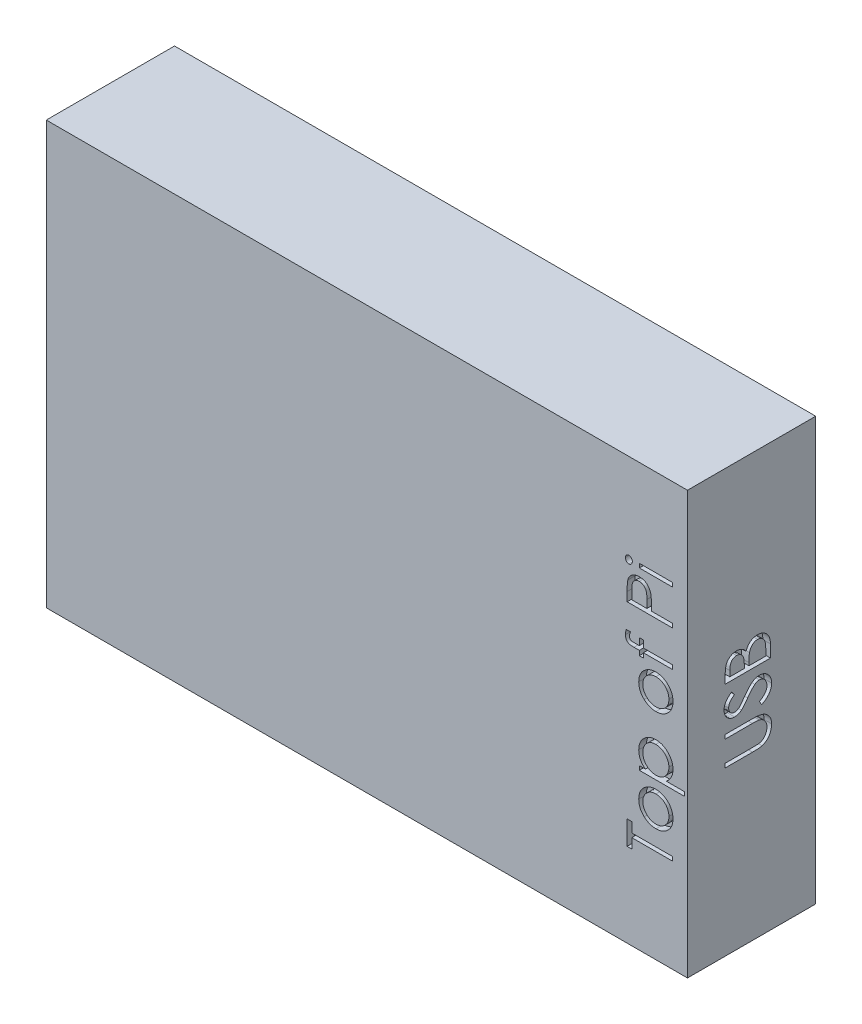
from build123d import *

# Parameters (mm, degrees)
SKETCH1_W           = 85
SKETCH1_H           = 56
BOSS_EXTRUDE1_DEPTH = 17
CUT_EXTRUDE1_DEPTH  = 1
SKETCH3_W           = 4.384615385
SKETCH3_H           = 0.538461538
CUT_EXTRUDE2_DEPTH  = 1


with BuildPart() as part:
    # Sketch1 → Boss-Extrude1 (new body)
    with BuildSketch(Plane.XY):
        with Locations((42.5, 28)):
            Rectangle(SKETCH1_W, SKETCH1_H)
    extrude(amount=BOSS_EXTRUDE1_DEPTH)

    # Sketch2 → Cut-Extrude1 (cut)
    # profile 1 of 3: a face of its own
    with BuildSketch(Plane(origin=(85, 0, 0), x_dir=(0, 0, -1), z_dir=(1, 0, 0))):
        with BuildLine():
            Line((-12, 21.615384615), (-12, 22.153846154))
            Line((-12, 22.153846154), (-8.405048077, 22.153846154))
            add(Edge.make_bspline(
                [(-8.405048077, 22.153846154), (-8.354166816, 22.153766021), (-8.257610854, 22.153613956), (-8.120179482, 22.154629694), (-7.997998123, 22.157474326), (-7.890595813, 22.159267742), (-7.798465389, 22.163257457), (-7.721107714, 22.166511251), (-7.658889081, 22.170695063), (-7.622578922, 22.175723264), (-7.606971154, 22.177884615)],
                knots=[0, 0, 0, 0, 1.528628734, 2.90083645, 4.128790002, 5.200304208, 6.127813768, 6.898992206, 7.526736466, 8, 8, 8, 8], degree=3))
            add(Edge.make_bspline(
                [(-7.606971154, 22.177884615), (-7.550230686, 22.186659158), (-7.440695762, 22.203598018), (-7.284828328, 22.248601408), (-7.144094184, 22.308598175), (-7.015318865, 22.383027754), (-6.899320752, 22.477069849), (-6.795209546, 22.593826014), (-6.700598922, 22.731202968), (-6.61811206, 22.887232503), (-6.54959977, 23.053482245), (-6.498334993, 23.223992144), (-6.466960983, 23.395471362), (-6.463337709, 23.510290663), (-6.461538462, 23.567307692)],
                knots=[0, 0, 0, 0, 1.042777144, 2.01303441, 2.939567723, 3.817555404, 4.708046775, 5.641195415, 6.651191522, 7.732783915, 8.843021186, 9.914367358, 10.964315445, 12, 12, 12, 12], degree=3))
            add(Edge.make_bspline(
                [(-6.461538462, 23.567307692), (-6.463369143, 23.616261265), (-6.467019933, 23.713885668), (-6.489905795, 23.85886117), (-6.530338533, 24.000505204), (-6.585415301, 24.137705033), (-6.653144963, 24.268230926), (-6.734283996, 24.388736365), (-6.828795256, 24.496728805), (-6.933539817, 24.595277925), (-7.051574826, 24.680589656), (-7.180052672, 24.756018567), (-7.322399162, 24.815922989), (-7.422376612, 24.846252416), (-7.473557692, 24.861778846)],
                knots=[0, 0, 0, 0, 0.994718802, 1.98369237, 2.973235266, 3.981451368, 4.982709966, 5.955777334, 6.925228988, 7.892833478, 8.871333226, 9.877970804, 10.913677552, 12, 12, 12, 12], degree=3))
            add(Edge.make_bspline(
                [(-7.473557692, 24.861778846), (-7.494726677, 24.866921918), (-7.541899706, 24.878382755), (-7.621650489, 24.889091975), (-7.715746542, 24.900246019), (-7.824863935, 24.907985281), (-7.948637031, 24.915530231), (-8.087710615, 24.92004407), (-8.241579691, 24.922130412), (-8.348957683, 24.92275215), (-8.405048077, 24.923076923)],
                knots=[0, 0, 0, 0, 0.558680831, 1.244966039, 2.062412453, 2.990489873, 4.051219941, 5.244515665, 6.560634259, 8, 8, 8, 8], degree=3))
            Line((-8.405048077, 24.923076923), (-12, 24.923076923))
            Line((-12, 24.923076923), (-12, 25.461538462))
            Line((-12, 25.461538462), (-8.376201923, 25.461538462))
            add(Edge.make_bspline(
                [(-8.376201923, 25.461538462), (-8.310890429, 25.461102765), (-8.183431078, 25.460252475), (-7.99665714, 25.45288092), (-7.819481236, 25.44112302), (-7.651875918, 25.42452532), (-7.494453411, 25.402483171), (-7.346176809, 25.378197749), (-7.207863613, 25.346729836), (-7.077918045, 25.3102462), (-6.953596944, 25.269134125), (-6.83584116, 25.214951023), (-6.721192193, 25.154169825), (-6.610933807, 25.082663947), (-6.505766521, 25.000399547), (-6.402967956, 24.91052827), (-6.305601787, 24.809882412), (-6.212467158, 24.701434738), (-6.125851929, 24.585914396), (-6.050477044, 24.462575475), (-5.98910145, 24.332098915), (-5.934629401, 24.197574308), (-5.895912056, 24.055776345), (-5.86647349, 23.908471323), (-5.849886979, 23.754785501), (-5.847408773, 23.650277224), (-5.846153846, 23.597355769)],
                knots=[0, 0, 0, 0, 1.316707045, 2.569633854, 3.76780728, 4.896239288, 5.964314126, 6.972204208, 7.924543903, 8.822147865, 9.693191779, 10.560896119, 11.431827672, 12.307838457, 13.206132673, 14.12176355, 15.058527151, 16.026630406, 17.00238624, 17.966538933, 18.934743273, 19.906713913, 20.888635248, 21.892958714, 22.933025263, 24, 24, 24, 24], degree=3))
            add(Edge.make_bspline(
                [(-5.846153846, 23.597355769), (-5.847498226, 23.539636886), (-5.850135894, 23.426392644), (-5.865273813, 23.259533356), (-5.89371437, 23.099544404), (-5.930162332, 22.944864336), (-5.979610052, 22.796987534), (-6.040368112, 22.655957577), (-6.109732669, 22.520155147), (-6.191697829, 22.39263984), (-6.281075319, 22.272365607), (-6.379246692, 22.16306383), (-6.482473079, 22.061959872), (-6.594641472, 21.973510172), (-6.713455682, 21.894369268), (-6.839474548, 21.826281069), (-6.972529135, 21.767795686), (-7.065021067, 21.737613751), (-7.111778846, 21.722355769)],
                knots=[0, 0, 0, 0, 1.138939089, 2.234594419, 3.301501784, 4.342532435, 5.367382236, 6.373123747, 7.370098489, 8.372230273, 9.360297234, 10.323289009, 11.268038109, 12.20748145, 13.137029304, 14.081414587, 15.030090602, 16, 16, 16, 16], degree=3))
            add(Edge.make_bspline(
                [(-7.111778846, 21.722355769), (-7.143720402, 21.713480641), (-7.213002349, 21.69423029), (-7.327664901, 21.673615494), (-7.459690474, 21.65628564), (-7.609088106, 21.639990397), (-7.775973591, 21.630375041), (-7.96027459, 21.621945146), (-8.162213953, 21.615325228), (-8.302878837, 21.615364266), (-8.376201923, 21.615384615)],
                knots=[0, 0, 0, 0, 0.625038921, 1.35572334, 2.194682327, 3.136881307, 4.189498639, 5.346923369, 6.617055217, 8, 8, 8, 8], degree=3))
            Line((-8.376201923, 21.615384615), (-12, 21.615384615))
        make_face()
    # profile 2 of 3: a face of its own
    with BuildSketch(Plane(origin=(85, 0, 0), x_dir=(0, 0, -1), z_dir=(1, 0, 0))):
        with BuildLine():
            Line((-7.157451923, 26.461538462), (-7.461538462, 26.96875))
            add(Edge.make_bspline(
                [(-7.461538462, 26.96875), (-7.382570944, 27.015924121), (-7.231272229, 27.106307916), (-7.026829874, 27.257081675), (-6.853066177, 27.413309523), (-6.710991993, 27.57614838), (-6.599136758, 27.744604291), (-6.519932932, 27.919776955), (-6.470534117, 28.101076059), (-6.464533969, 28.224459753), (-6.461538462, 28.286057692)],
                knots=[0, 0, 0, 0, 1.272034388, 2.437168799, 3.508375237, 4.49857839, 5.41946034, 6.295179144, 7.148887113, 8, 8, 8, 8], degree=3))
            add(Edge.make_bspline(
                [(-6.461538462, 28.286057692), (-6.463038471, 28.338653089), (-6.466012244, 28.442923586), (-6.493431903, 28.596727413), (-6.538290409, 28.745354288), (-6.59910097, 28.887326766), (-6.673850371, 29.018883507), (-6.761993942, 29.136095913), (-6.863840684, 29.235069364), (-6.975617656, 29.317119551), (-7.095480057, 29.38060939), (-7.218981235, 29.428595627), (-7.34781572, 29.455470505), (-7.434579988, 29.459503313), (-7.478365385, 29.461538462)],
                knots=[0, 0, 0, 0, 1.09553864, 2.171907928, 3.244545276, 4.325730702, 5.384330216, 6.391480148, 7.371786628, 8.333890167, 9.27165687, 10.191402356, 11.087295184, 12, 12, 12, 12], degree=3))
            add(Edge.make_bspline(
                [(-7.478365385, 29.461538462), (-7.528337801, 29.459065355), (-7.629537393, 29.454057043), (-7.779100964, 29.409918465), (-7.927750556, 29.342520703), (-8.019717224, 29.279174381), (-8.067307692, 29.246394231)],
                knots=[0, 0, 0, 0, 0.938992559, 1.901562324, 2.914110574, 4, 4, 4, 4], degree=3))
            add(Edge.make_bspline(
                [(-8.067307692, 29.246394231), (-8.101678021, 29.219534259), (-8.173834225, 29.163145108), (-8.281149766, 29.066120223), (-8.392069958, 28.952847754), (-8.509029888, 28.824878017), (-8.631058104, 28.681996351), (-8.75910685, 28.524147476), (-8.890559439, 28.349984242), (-8.978607244, 28.227739655), (-9.024038462, 28.164663462)],
                knots=[0, 0, 0, 0, 0.72225051, 1.516274602, 2.393638633, 3.3469932, 4.386926276, 5.505032946, 6.712638081, 8, 8, 8, 8], degree=3))
            add(Edge.make_bspline(
                [(-9.024038462, 28.164663462), (-9.069001755, 28.101536611), (-9.154968147, 27.98084288), (-9.282552634, 27.812056739), (-9.399199267, 27.661123373), (-9.506006145, 27.528713631), (-9.602987753, 27.41488575), (-9.689212792, 27.31874276), (-9.767013182, 27.242733805), (-9.817484054, 27.200467095), (-9.840144231, 27.181490385)],
                knots=[0, 0, 0, 0, 1.452282411, 2.77665338, 3.964542531, 5.026858415, 5.96415736, 6.766646006, 7.446254459, 8, 8, 8, 8], degree=3))
            add(Edge.make_bspline(
                [(-9.840144231, 27.181490385), (-9.875462047, 27.154970467), (-9.944919273, 27.10281549), (-10.05345119, 27.033896129), (-10.164339908, 26.975776244), (-10.277987314, 26.929000603), (-10.393539278, 26.891174914), (-10.511863321, 26.864876357), (-10.632156186, 26.848666482), (-10.713090814, 26.846992049), (-10.753605769, 26.846153846)],
                knots=[0, 0, 0, 0, 1.068019517, 2.100403715, 3.106014851, 4.09224787, 5.069873182, 6.043214339, 7.020455327, 8, 8, 8, 8], degree=3))
            add(Edge.make_bspline(
                [(-10.753605769, 26.846153846), (-10.817085507, 26.848391248), (-10.942688147, 26.852818228), (-11.12616777, 26.89026056), (-11.301351196, 26.949351563), (-11.466463705, 27.032163029), (-11.617356803, 27.13881426), (-11.755388673, 27.262772932), (-11.873011906, 27.409047543), (-11.974180246, 27.57098441), (-12.054184634, 27.747305723), (-12.112164093, 27.932933723), (-12.146603163, 28.126534058), (-12.151408101, 28.257875729), (-12.153846154, 28.324519231)],
                knots=[0, 0, 0, 0, 1.005248779, 1.989011071, 2.95484373, 3.928844559, 4.904706341, 5.875556129, 6.859318422, 7.868909462, 8.894684146, 9.918924798, 10.944050749, 12, 12, 12, 12], degree=3))
            add(Edge.make_bspline(
                [(-12.153846154, 28.324519231), (-12.151440607, 28.395234851), (-12.146656743, 28.53586565), (-12.104027118, 28.742395455), (-12.03618014, 28.94205422), (-11.95657786, 29.101954632), (-11.877580259, 29.227365604), (-11.8054695, 29.322911484), (-11.72262443, 29.420259229), (-11.627298548, 29.518362642), (-11.521398466, 29.618190208), (-11.404027732, 29.719282098), (-11.276244048, 29.822584357), (-11.184998145, 29.889019241), (-11.138221154, 29.923076923)],
                knots=[0, 0, 0, 0, 1.286507425, 2.558452658, 3.822738219, 5.118007103, 5.800084425, 6.519418873, 7.295692132, 8.12638276, 9.008892966, 9.945018126, 10.946518512, 12, 12, 12, 12], degree=3))
            Line((-11.138221154, 29.923076923), (-10.769230769, 29.436298077))
            add(Edge.make_bspline(
                [(-10.769230769, 29.436298077), (-10.807099287, 29.406907193), (-10.880025199, 29.350307222), (-10.982118303, 29.264342453), (-11.075502479, 29.183441366), (-11.156400582, 29.10312428), (-11.23087058, 29.029582016), (-11.293497436, 28.956937142), (-11.346259861, 28.887993037), (-11.402669915, 28.801297729), (-11.45689589, 28.691474633), (-11.504527036, 28.554762553), (-11.532784373, 28.411409992), (-11.536553467, 28.313824753), (-11.538461538, 28.264423077)],
                knots=[0, 0, 0, 0, 1.181392137, 2.275085037, 3.289537922, 4.225335853, 5.084247276, 5.86831218, 6.587234301, 7.222706459, 8.415108401, 9.595592188, 10.782789524, 12, 12, 12, 12], degree=3))
            add(Edge.make_bspline(
                [(-11.538461538, 28.264423077), (-11.536418352, 28.20242584), (-11.532478258, 28.082870009), (-11.488314189, 27.913531167), (-11.421165697, 27.760237257), (-11.324338272, 27.628840248), (-11.208901332, 27.520347776), (-11.077253631, 27.440894582), (-10.931853868, 27.393390914), (-10.83047618, 27.387576548), (-10.778846154, 27.384615385)],
                knots=[0, 0, 0, 0, 1.144248881, 2.206576175, 3.214949548, 4.222996039, 5.203671638, 6.127710127, 7.046472867, 8, 8, 8, 8], degree=3))
            add(Edge.make_bspline(
                [(-10.778846154, 27.384615385), (-10.746708133, 27.385327816), (-10.681984397, 27.386762603), (-10.586815639, 27.405096858), (-10.492148675, 27.429886277), (-10.398316684, 27.467889646), (-10.303194902, 27.520812484), (-10.205439813, 27.590235912), (-10.10420941, 27.677691649), (-10.038368033, 27.744680161), (-10.003605769, 27.780048077)],
                knots=[0, 0, 0, 0, 0.858259122, 1.72847414, 2.583651051, 3.473048463, 4.427392529, 5.488649985, 6.674082839, 8, 8, 8, 8], degree=3))
            add(Edge.make_bspline(
                [(-10.003605769, 27.780048077), (-9.991885154, 27.793181858), (-9.964039654, 27.824384716), (-9.918452887, 27.88142916), (-9.862219563, 27.956759672), (-9.792641306, 28.048409159), (-9.711930228, 28.158067494), (-9.621118322, 28.285746733), (-9.517257535, 28.430023646), (-9.444644608, 28.532404073), (-9.40625, 28.586538462)],
                knots=[0, 0, 0, 0, 0.420754252, 0.999615792, 1.744751191, 2.668019286, 3.750313428, 4.999500688, 6.413464383, 8, 8, 8, 8], degree=3))
            add(Edge.make_bspline(
                [(-9.40625, 28.586538462), (-9.358864779, 28.651657124), (-9.267109865, 28.777750389), (-9.129254866, 28.957164004), (-8.99442857, 29.119836976), (-8.863500737, 29.266352473), (-8.737435232, 29.398117653), (-8.61481311, 29.513804247), (-8.49643851, 29.613937153), (-8.345706932, 29.723209586), (-8.158869622, 29.83354235), (-7.929855494, 29.928143627), (-7.700184167, 29.988327339), (-7.546016905, 29.996143543), (-7.469951923, 30)],
                knots=[0, 0, 0, 0, 1.163604038, 2.253157948, 3.268574773, 4.215621239, 5.091738613, 5.902582348, 6.650434646, 7.330118262, 8.591011492, 9.77460283, 10.902005569, 12, 12, 12, 12], degree=3))
            add(Edge.make_bspline(
                [(-7.469951923, 30), (-7.41616101, 29.998872329), (-7.309623767, 29.996638886), (-7.153178206, 29.971008302), (-7.001270389, 29.933369638), (-6.855928256, 29.877096706), (-6.714819752, 29.807293512), (-6.580603088, 29.719989816), (-6.450670723, 29.618264486), (-6.328665336, 29.501633276), (-6.216526665, 29.374077268), (-6.117186369, 29.238774096), (-6.032448299, 29.097136201), (-5.964962736, 28.947629741), (-5.911825906, 28.791860811), (-5.873433418, 28.629315744), (-5.849844176, 28.459829885), (-5.847397689, 28.344628408), (-5.846153846, 28.286057692)],
                knots=[0, 0, 0, 0, 0.983922938, 1.948738757, 2.895227473, 3.844781104, 4.796118043, 5.772795661, 6.770647148, 7.813532943, 8.8582745, 9.876489951, 10.882905461, 11.874265028, 12.874055871, 13.891769171, 14.928133632, 16, 16, 16, 16], degree=3))
            add(Edge.make_bspline(
                [(-5.846153846, 28.286057692), (-5.847030158, 28.240739962), (-5.848771744, 28.15067523), (-5.864168223, 28.017458974), (-5.885951835, 27.886933971), (-5.920535934, 27.760738034), (-5.962496544, 27.637245419), (-6.014161964, 27.516992674), (-6.076078276, 27.399923596), (-6.146865487, 27.285374175), (-6.229266766, 27.173666448), (-6.325155256, 27.065727046), (-6.432085826, 26.958716387), (-6.551710372, 26.853393566), (-6.68534435, 26.752056396), (-6.830997227, 26.652272096), (-6.989102143, 26.55452696), (-7.10028719, 26.493113571), (-7.157451923, 26.461538462)],
                knots=[0, 0, 0, 0, 0.915313873, 1.819100311, 2.706792138, 3.586475221, 4.459428225, 5.3405999, 6.2277379, 7.133009489, 8.059106158, 9.028520402, 10.047404263, 11.114294124, 12.246039232, 13.433834781, 14.680630578, 16, 16, 16, 16], degree=3))
        make_face()
    # profile 3 of 3: a face of its own
    with BuildSketch(Plane(origin=(85, 0, 0), x_dir=(0, 0, -1), z_dir=(1, 0, 0))):
        with BuildLine():
            Line((-12, 31.230769231), (-12, 32.401442308))
            add(Edge.make_bspline(
                [(-12, 32.401442308), (-11.999703457, 32.458749174), (-11.999128682, 32.569824143), (-11.990007425, 32.731330904), (-11.977881577, 32.882657127), (-11.95754112, 33.0235354), (-11.936450748, 33.154882396), (-11.905495132, 33.275364667), (-11.871303525, 33.385991404), (-11.818695099, 33.51883147), (-11.736993549, 33.669556728), (-11.615822388, 33.831558178), (-11.47054795, 33.972379723), (-11.304996269, 34.092119777), (-11.122870659, 34.188213719), (-10.928089612, 34.256853949), (-10.723930087, 34.300951048), (-10.583959855, 34.305429148), (-10.513221154, 34.307692308)],
                knots=[0, 0, 0, 0, 1.00128172, 1.940733171, 2.826250472, 3.653024905, 4.427672124, 5.149348099, 5.824709082, 6.450061444, 7.643590664, 8.808605388, 9.972104426, 11.165284501, 12.367876273, 13.557044126, 14.765369432, 16, 16, 16, 16], degree=3))
            add(Edge.make_bspline(
                [(-10.513221154, 34.307692308), (-10.446962543, 34.305807261), (-10.316758125, 34.302102966), (-10.126647541, 34.267112731), (-9.945863489, 34.211578227), (-9.774560694, 34.134827303), (-9.61592797, 34.035938032), (-9.47045672, 33.917454785), (-9.343644957, 33.77509811), (-9.272776706, 33.668387067), (-9.236778846, 33.614182692)],
                knots=[0, 0, 0, 0, 1.044641374, 2.052818814, 3.038628718, 4.023282556, 5.005660861, 5.98021751, 6.974042014, 8, 8, 8, 8], degree=3))
            add(Edge.make_bspline(
                [(-9.236778846, 33.614182692), (-9.210601803, 33.682336844), (-9.160518635, 33.812732618), (-9.072110629, 33.992279742), (-8.975604841, 34.146406862), (-8.871843881, 34.278124774), (-8.758351089, 34.390182622), (-8.634204387, 34.487231198), (-8.499505409, 34.571131582), (-8.354749217, 34.64253023), (-8.201162974, 34.698614757), (-8.040622586, 34.739836108), (-7.873743483, 34.764219433), (-7.760495982, 34.767545692), (-7.703125, 34.769230769)],
                knots=[0, 0, 0, 0, 1.272586185, 2.434772614, 3.483318042, 4.437947805, 5.351807173, 6.25737843, 7.180033415, 8.1141739, 9.066731021, 10.025721652, 10.999834114, 12, 12, 12, 12], degree=3))
            add(Edge.make_bspline(
                [(-7.703125, 34.769230769), (-7.644552981, 34.767556542), (-7.529310892, 34.764262453), (-7.36001978, 34.739948702), (-7.198221646, 34.698809447), (-7.04294451, 34.64204536), (-6.894513934, 34.568469655), (-6.753467632, 34.477636329), (-6.61951216, 34.370820499), (-6.492411103, 34.250101346), (-6.37610964, 34.115569293), (-6.276129603, 33.967306313), (-6.19016102, 33.809374087), (-6.120168465, 33.639753604), (-6.066169256, 33.458877869), (-6.028546659, 33.266847531), (-6.003154075, 33.063978835), (-6.001069198, 32.9247611), (-6, 32.853365385)],
                knots=[0, 0, 0, 0, 0.978680899, 1.925582087, 2.851223405, 3.764209995, 4.683484765, 5.614004905, 6.562443559, 7.542772147, 8.539900013, 9.527881485, 10.525548727, 11.540192123, 12.58875426, 13.674701727, 14.807505862, 16, 16, 16, 16], degree=3))
            Line((-6, 32.853365385), (-6, 31.230769231))
            Line((-6, 31.230769231), (-12, 31.230769231))
        make_face()
        with BuildLine():
            Line((-11.384615385, 31.769230769), (-9.461538462, 31.769230769))
            Line((-9.461538462, 31.769230769), (-9.461538462, 32.131009615))
            add(Edge.make_bspline(
                [(-9.461538462, 32.131009615), (-9.462224044, 32.183893265), (-9.463548728, 32.286075252), (-9.46734333, 32.434052216), (-9.477968543, 32.571409396), (-9.488590722, 32.697909663), (-9.505861394, 32.81335391), (-9.52641948, 32.917486057), (-9.548161084, 33.011941399), (-9.585139539, 33.120863784), (-9.639772111, 33.244434712), (-9.724639719, 33.376080253), (-9.825642887, 33.492675365), (-9.94327669, 33.589952684), (-10.071400586, 33.670269634), (-10.208889768, 33.726534183), (-10.352977443, 33.764044083), (-10.452084821, 33.767484164), (-10.502403846, 33.769230769)],
                knots=[0, 0, 0, 0, 1.156917035, 2.235399477, 3.236897345, 4.169954739, 5.01148057, 5.788325709, 6.491867502, 7.129259015, 8.302032419, 9.437271567, 10.542795419, 11.662606952, 12.764338259, 13.836858145, 14.901724648, 16, 16, 16, 16], degree=3))
            add(Edge.make_bspline(
                [(-10.502403846, 33.769230769), (-10.535709534, 33.76834395), (-10.601042278, 33.766604358), (-10.696591752, 33.751839518), (-10.786373211, 33.727916558), (-10.87124833, 33.695518421), (-10.949107761, 33.651257758), (-11.023671827, 33.599953835), (-11.090474506, 33.536611858), (-11.152731939, 33.4650298), (-11.208452134, 33.383127159), (-11.254607679, 33.289139339), (-11.296439938, 33.185496071), (-11.327407116, 33.069385455), (-11.354637894, 32.943213343), (-11.371747174, 32.805271318), (-11.382757158, 32.656433489), (-11.38398216, 32.553307568), (-11.384615385, 32.5)],
                knots=[0, 0, 0, 0, 0.911708768, 1.788416306, 2.640049961, 3.452993646, 4.268229297, 5.087074648, 5.92553149, 6.781184137, 7.681934069, 8.628939405, 9.643570426, 10.73771997, 11.914765019, 13.176320755, 14.540391495, 16, 16, 16, 16], degree=3))
            Line((-11.384615385, 32.5), (-11.384615385, 31.769230769))
        make_face(mode=Mode.SUBTRACT)
        with BuildLine():
            Line((-8.846153846, 31.769230769), (-6.615384615, 31.769230769))
            Line((-6.615384615, 31.769230769), (-6.615384615, 32.536057692))
            add(Edge.make_bspline(
                [(-6.615384615, 32.536057692), (-6.616107881, 32.590941539), (-6.617501879, 32.696722917), (-6.620771096, 32.84957333), (-6.633138046, 32.990872345), (-6.644546502, 33.121065711), (-6.664054471, 33.239807893), (-6.682464922, 33.348012263), (-6.709793921, 33.443902572), (-6.747354415, 33.556116419), (-6.807484103, 33.681545563), (-6.89533301, 33.81861704), (-7.003752122, 33.938141244), (-7.12705833, 34.040741615), (-7.260759887, 34.125411897), (-7.403108902, 34.186170834), (-7.551336955, 34.223928604), (-7.65242713, 34.228484431), (-7.703125, 34.230769231)],
                knots=[0, 0, 0, 0, 1.160376723, 2.23647316, 3.230273494, 4.158083346, 4.997711197, 5.773399541, 6.476071462, 7.102777513, 8.27340052, 9.405620712, 10.53304798, 11.669441455, 12.787990954, 13.865552736, 14.929550474, 16, 16, 16, 16], degree=3))
            add(Edge.make_bspline(
                [(-7.703125, 34.230769231), (-7.734828552, 34.230297359), (-7.797724276, 34.229361226), (-7.89014144, 34.215179039), (-7.979708286, 34.194661909), (-8.066798055, 34.167640259), (-8.149946445, 34.129865449), (-8.229472333, 34.083556698), (-8.306977741, 34.030548104), (-8.406230129, 33.948765871), (-8.51916558, 33.828076158), (-8.628370556, 33.656562607), (-8.717862978, 33.462622395), (-8.755696543, 33.321630728), (-8.775240385, 33.248798077)],
                knots=[0, 0, 0, 0, 0.723302347, 1.434937762, 2.129609326, 2.821140842, 3.513216847, 4.209993937, 4.920569932, 5.655069131, 7.14393391, 8.6716197, 10.280644748, 12, 12, 12, 12], degree=3))
            add(Edge.make_bspline(
                [(-8.775240385, 33.248798077), (-8.781163386, 33.219605341), (-8.794005674, 33.156309469), (-8.807561737, 33.053096474), (-8.819638982, 32.935263555), (-8.828572395, 32.802538623), (-8.83780647, 32.654753753), (-8.841397592, 32.491593321), (-8.845682038, 32.313723638), (-8.845992554, 32.190308143), (-8.846153846, 32.126201923)],
                knots=[0, 0, 0, 0, 0.634451884, 1.375622551, 2.216452059, 3.157844607, 4.20941857, 5.370758133, 6.634282058, 8, 8, 8, 8], degree=3))
            Line((-8.846153846, 32.126201923), (-8.846153846, 31.769230769))
        make_face(mode=Mode.SUBTRACT)
    extrude(amount=-CUT_EXTRUDE1_DEPTH, mode=Mode.SUBTRACT)

    # Sketch3 → Cut-Extrude2 (cut)
    # profile 1 of 8: a face of its own
    with BuildSketch(Plane.XY.offset(17)):
        Polygon((77.615384615, 11.115384615), (77, 11.115384615), (77, 14.269230769), (77.615384615, 14.269230769), (77.615384615, 12.961538462), (83, 12.961538462), (83, 12.423076923), (77.615384615, 12.423076923), align=None)
    # profile 2 of 8: a face of its own
    with BuildSketch(Plane.XY.offset(17)):
        with BuildLine():
            add(Edge.make_bspline(
                [(78.538461538, 17.310096154), (78.540213352, 17.392366907), (78.54364823, 17.553679749), (78.580359599, 17.789921839), (78.636497938, 18.015427786), (78.714106331, 18.231061259), (78.818132531, 18.434060622), (78.942262745, 18.627382755), (79.08931862, 18.810497627), (79.203075308, 18.920251392), (79.260817308, 18.975961538)],
                knots=[0, 0, 0, 0, 1.054011418, 2.066658804, 3.057071809, 4.030435133, 4.997543892, 5.974964718, 6.972108034, 8, 8, 8, 8], degree=3))
            add(Edge.make_bspline(
                [(79.260817308, 18.975961538), (79.316041283, 19.023930603), (79.425420499, 19.118940397), (79.602772978, 19.240767344), (79.786441722, 19.34571859), (79.97886571, 19.429826523), (80.178365147, 19.496143706), (80.385625737, 19.543227757), (80.600189761, 19.571233931), (80.745910626, 19.575010446), (80.819711538, 19.576923077)],
                knots=[0, 0, 0, 0, 1.025258237, 2.030674902, 3.01204498, 3.988269485, 4.97094183, 5.956517959, 6.965070386, 8, 8, 8, 8], degree=3))
            add(Edge.make_bspline(
                [(80.819711538, 19.576923077), (80.893940209, 19.575240784), (81.040619523, 19.571916496), (81.256652722, 19.540470296), (81.46612956, 19.491559863), (81.668173035, 19.421562427), (81.86340074, 19.331805668), (82.050959967, 19.222278775), (82.231220767, 19.092213145), (82.40265249, 18.944777722), (82.560651715, 18.781831649), (82.69835732, 18.605061109), (82.816337076, 18.417939908), (82.911370931, 18.217979874), (82.986301846, 18.00700704), (83.038930446, 17.784566351), (83.070750475, 17.551003374), (83.074836601, 17.391528137), (83.076923077, 17.310096154)],
                knots=[0, 0, 0, 0, 0.998656419, 1.973391657, 2.932242238, 3.890759089, 4.846373663, 5.82037756, 6.809684879, 7.83454468, 8.860553229, 9.859544525, 10.845671541, 11.83227036, 12.833544569, 13.85385346, 14.904124723, 16, 16, 16, 16], degree=3))
            add(Edge.make_bspline(
                [(83.076923077, 17.310096154), (83.074829598, 17.228265206), (83.070729413, 17.067995161), (83.039054071, 16.833607763), (82.986326101, 16.610768417), (82.911124685, 16.399519391), (82.816334038, 16.198699653), (82.698713999, 16.01049423), (82.560610876, 15.833580089), (82.402663555, 15.670599544), (82.231217916, 15.523173363), (82.050960707, 15.393105349), (81.863400547, 15.283579076), (81.668173087, 15.193822155), (81.466129547, 15.123824761), (81.256652725, 15.074914317), (81.040619522, 15.04346812), (80.893940208, 15.040143831), (80.819711538, 15.038461538)],
                knots=[0, 0, 0, 0, 1.099876186, 2.154163076, 3.173186993, 4.173200201, 5.163417411, 6.152872554, 7.150605724, 8.17532212, 9.198891216, 10.186952605, 11.159729845, 12.11414092, 13.071450619, 14.029093627, 15.002601286, 16, 16, 16, 16], degree=3))
            add(Edge.make_bspline(
                [(80.819711538, 15.038461538), (80.746310108, 15.040382638), (80.60098789, 15.044186086), (80.386850976, 15.07223048), (80.180224723, 15.11880222), (79.981814714, 15.186038749), (79.789853212, 15.269990552), (79.60551104, 15.373885509), (79.428933516, 15.496890927), (79.319699351, 15.591531611), (79.264423077, 15.639423077)],
                knots=[0, 0, 0, 0, 1.031377469, 2.041950136, 3.029500481, 4.003457997, 4.981637986, 5.969878303, 6.97268806, 8, 8, 8, 8], degree=3))
            add(Edge.make_bspline(
                [(79.264423077, 15.639423077), (79.206180324, 15.695049233), (79.091635702, 15.804447857), (78.945008518, 15.988474247), (78.818295248, 16.181320798), (78.716336022, 16.386563528), (78.63604142, 16.602019856), (78.580214823, 16.828681415), (78.5437805, 17.065725155), (78.540252195, 17.227827363), (78.538461538, 17.310096154)],
                knots=[0, 0, 0, 0, 1.027980169, 2.021703884, 2.998553061, 3.971491411, 4.943284454, 5.930300938, 6.949603206, 8, 8, 8, 8], degree=3))
        make_face()
        with BuildLine():
            add(Edge.make_bspline(
                [(79.076923077, 17.307692308), (79.078576663, 17.249513545), (79.081841147, 17.134657896), (79.106670699, 16.965595752), (79.146009274, 16.802841196), (79.201901953, 16.646085488), (79.274071453, 16.495857101), (79.362714512, 16.352012755), (79.466656121, 16.214127244), (79.585737319, 16.084905996), (79.715806937, 15.966288648), (79.854435399, 15.862681099), (79.999499204, 15.774085485), (80.151216646, 15.701619533), (80.310105027, 15.646043294), (80.475228646, 15.606660915), (80.647086121, 15.581785899), (80.763937169, 15.578561578), (80.823317308, 15.576923077)],
                knots=[0, 0, 0, 0, 1.02155314, 2.01673505, 2.994700672, 3.958461264, 4.934171024, 5.916582427, 6.921469794, 7.962398674, 8.998583302, 10.009097305, 10.997513862, 11.97957236, 12.956600784, 13.948243505, 14.957359924, 16, 16, 16, 16], degree=3))
            add(Edge.make_bspline(
                [(80.823317308, 15.576923077), (80.900035069, 15.579677632), (81.052305478, 15.585144908), (81.276553117, 15.629605313), (81.491836292, 15.703981793), (81.696892954, 15.80441713), (81.886616859, 15.930256362), (82.055767975, 16.078519905), (82.201800795, 16.247616534), (82.322967958, 16.435530534), (82.419241825, 16.638423651), (82.487468641, 16.853148772), (82.531820113, 17.077104248), (82.536228355, 17.23015693), (82.538461538, 17.307692308)],
                knots=[0, 0, 0, 0, 1.016792936, 2.018143844, 3.017858371, 4.030088057, 5.03801393, 6.028138512, 7.003788237, 7.991172063, 8.984598303, 9.972568034, 10.972917682, 12, 12, 12, 12], degree=3))
            add(Edge.make_bspline(
                [(82.538461538, 17.307692308), (82.536215344, 17.385223226), (82.531781418, 17.538267105), (82.487692012, 17.761911408), (82.41894288, 17.976049645), (82.323076234, 18.178732024), (82.201340666, 18.366560487), (82.056592591, 18.536873266), (81.886168846, 18.683870885), (81.696641654, 18.809585637), (81.492154193, 18.911665767), (81.276513383, 18.985694113), (81.052315597, 19.030261403), (80.900038459, 19.035714252), (80.823317308, 19.038461538)],
                knots=[0, 0, 0, 0, 1.02726834, 2.027799167, 3.010890988, 4.004497153, 4.992059811, 5.971914811, 6.958719428, 7.966827853, 8.981595046, 9.981490638, 10.983022906, 12, 12, 12, 12], degree=3))
            add(Edge.make_bspline(
                [(80.823317308, 19.038461538), (80.763936814, 19.036823602), (80.647085069, 19.033600394), (80.475232669, 19.008717288), (80.310090308, 18.969364782), (80.151270849, 18.913678689), (79.999105573, 18.841534626), (79.854860624, 18.751235865), (79.71532683, 18.648051492), (79.586157802, 18.528003048), (79.466609703, 18.398916673), (79.362674206, 18.260975285), (79.27446103, 18.117344235), (79.201284658, 17.967552289), (79.146517778, 17.810776483), (79.106443556, 17.648249969), (79.081946075, 17.479909154), (79.078608118, 17.36546508), (79.076923077, 17.307692308)],
                knots=[0, 0, 0, 0, 1.042975879, 2.052417305, 3.044379404, 4.0217225, 5.00409729, 5.996508862, 7.007348322, 8.048612455, 9.089876587, 10.095087598, 11.077815406, 12.047498138, 13.018202342, 13.98964644, 14.985148868, 16, 16, 16, 16], degree=3))
        make_face(mode=Mode.SUBTRACT)
    # profile 3 of 8: a face of its own
    with BuildSketch(Plane.XY.offset(17)):
        with BuildLine():
            Line((78.615384615, 20.653846154), (78.615384615, 21.192307692))
            Line((78.615384615, 21.192307692), (79.426682692, 21.192307692))
            add(Edge.make_bspline(
                [(79.426682692, 21.192307692), (79.353641708, 21.249656777), (79.211250583, 21.361457031), (79.024621206, 21.551234242), (78.870409634, 21.755132383), (78.746074798, 21.971865622), (78.654254646, 22.202809991), (78.585920457, 22.444664076), (78.545773635, 22.70018293), (78.540931153, 22.874859258), (78.538461538, 22.963942308)],
                knots=[0, 0, 0, 0, 1.07939028, 2.104237756, 3.085658289, 4.045737152, 5.001099604, 5.968961907, 6.964192404, 8, 8, 8, 8], degree=3))
            add(Edge.make_bspline(
                [(78.538461538, 22.963942308), (78.540712702, 23.041756485), (78.545162246, 23.195560293), (78.575287482, 23.4219544), (78.626917812, 23.639969343), (78.701319381, 23.848371721), (78.793300187, 24.049394119), (78.909386534, 24.240060576), (79.043797146, 24.423340957), (79.198480834, 24.594625852), (79.365843576, 24.752891054), (79.545881812, 24.889770221), (79.732674817, 25.007836343), (79.929118404, 25.103271137), (80.133665655, 25.178028304), (80.347142982, 25.231196323), (80.56875888, 25.262837997), (80.719449258, 25.267083343), (80.795673077, 25.269230769)],
                knots=[0, 0, 0, 0, 1.041296284, 2.058176809, 3.050446431, 4.034000596, 5.01514041, 6.003636468, 7.015969324, 8.052561599, 9.08815499, 10.094063707, 11.074456064, 12.040834395, 13.011057502, 13.983766392, 14.980127149, 16, 16, 16, 16], degree=3))
            add(Edge.make_bspline(
                [(80.795673077, 25.269230769), (80.873505606, 25.267129937), (81.027002585, 25.262986792), (81.252409037, 25.230852496), (81.469244535, 25.179497855), (81.677148416, 25.105683827), (81.875977532, 25.010298418), (82.065588497, 24.894233457), (82.24592056, 24.757285228), (82.414525531, 24.600769009), (82.569838639, 24.430963976), (82.70567533, 24.249459708), (82.819746259, 24.059072979), (82.915031332, 23.860777835), (82.986846505, 23.652876741), (83.038648449, 23.436339693), (83.070593299, 23.211284585), (83.074796972, 23.058196896), (83.076923077, 22.980769231)],
                knots=[0, 0, 0, 0, 1.038740735, 2.04854663, 3.033179607, 4.009277356, 4.987731542, 5.972001279, 6.972200261, 8.005528982, 9.039189865, 10.040446548, 11.026516639, 11.997840187, 12.972163198, 13.956796175, 14.96660207, 16, 16, 16, 16], degree=3))
            add(Edge.make_bspline(
                [(83.076923077, 22.980769231), (83.074530382, 22.893669142), (83.069805901, 22.721686219), (83.027873075, 22.469514105), (82.95900356, 22.227916577), (82.862420537, 21.997603485), (82.738376106, 21.777933343), (82.587379207, 21.569772356), (82.409456028, 21.372090004), (82.274489084, 21.253103074), (82.205528846, 21.192307692)],
                knots=[0, 0, 0, 0, 1.014661154, 2.003492687, 2.970165371, 3.937187664, 4.907406957, 5.904113462, 6.929124205, 8, 8, 8, 8], degree=3))
            Line((82.205528846, 21.192307692), (84.615384615, 21.192307692))
            Line((84.615384615, 21.192307692), (84.615384615, 20.653846154))
            Line((84.615384615, 20.653846154), (78.615384615, 20.653846154))
        make_face()
        with BuildLine():
            add(Edge.make_bspline(
                [(79.076923077, 22.959134615), (79.078020662, 22.89814108), (79.080181525, 22.778060529), (79.105851152, 22.602051011), (79.143115851, 22.432515992), (79.199536251, 22.271164075), (79.26879136, 22.116448733), (79.35533195, 21.969561593), (79.457592532, 21.830605763), (79.573614264, 21.699930854), (79.701456587, 21.581879494), (79.837892831, 21.477371617), (79.982750213, 21.389587665), (80.134679406, 21.316727059), (80.294871323, 21.261281432), (80.462413631, 21.221928769), (80.637489709, 21.197191022), (80.756728578, 21.193952844), (80.817307692, 21.192307692)],
                knots=[0, 0, 0, 0, 1.05670511, 2.080379991, 3.077984906, 4.06214886, 5.038337365, 6.01289324, 7.01187578, 8.025460281, 9.038092164, 10.024533457, 11.000252242, 11.969694649, 12.940728589, 13.933144304, 14.949937299, 16, 16, 16, 16], degree=3))
            add(Edge.make_bspline(
                [(80.817307692, 21.192307692), (80.896827135, 21.195046339), (81.052612458, 21.20041158), (81.279910388, 21.243613386), (81.494811188, 21.314712156), (81.695916342, 21.415233985), (81.88197893, 21.540799667), (82.046645998, 21.69483388), (82.192074595, 21.871609431), (82.31456689, 22.07063113), (82.413527701, 22.284181598), (82.486613026, 22.506186702), (82.529992422, 22.735088517), (82.535623213, 22.889641967), (82.538461538, 22.967548077)],
                knots=[0, 0, 0, 0, 1.037533453, 2.032615907, 3.008487753, 3.983910949, 4.958815134, 5.928528047, 6.917017829, 7.938835504, 8.970843303, 9.983125212, 10.983349323, 12, 12, 12, 12], degree=3))
            add(Edge.make_bspline(
                [(82.538461538, 22.967548077), (82.535793386, 23.043895018), (82.530497584, 23.195429972), (82.484661835, 23.418559497), (82.414637415, 23.635395551), (82.312551968, 23.841437875), (82.187363798, 24.03477777), (82.037294843, 24.209926791), (81.862168289, 24.36166065), (81.668464494, 24.492223857), (81.460943466, 24.596603848), (81.246616748, 24.675892221), (81.025523019, 24.721063448), (80.876393749, 24.727529737), (80.801682692, 24.730769231)],
                knots=[0, 0, 0, 0, 1.001123591, 1.987050352, 2.978152323, 3.984730168, 4.995502505, 5.994801396, 7.000994558, 8.027767845, 9.053126238, 10.042874082, 11.019515457, 12, 12, 12, 12], degree=3))
            add(Edge.make_bspline(
                [(80.801682692, 24.730769231), (80.726503992, 24.728273708), (80.576732309, 24.723302106), (80.355976791, 24.674389588), (80.140242927, 24.600748841), (79.935361568, 24.494035133), (79.743096901, 24.365493102), (79.571127264, 24.213467373), (79.423403684, 24.03917243), (79.298116268, 23.84733311), (79.200309527, 23.639462946), (79.12837876, 23.421300856), (79.085258421, 23.193201612), (79.079725965, 23.037843262), (79.076923077, 22.959134615)],
                knots=[0, 0, 0, 0, 0.984010603, 1.960354772, 2.950163297, 3.964735994, 4.97843856, 5.975353722, 6.962442164, 7.964544167, 8.969901786, 9.964615439, 10.968820376, 12, 12, 12, 12], degree=3))
        make_face(mode=Mode.SUBTRACT)
    # profile 4 of 8: a face of its own
    with BuildSketch(Plane.XY.offset(17)):
        with BuildLine():
            add(Edge.make_bspline(
                [(78.538461538, 30.771634615), (78.540213352, 30.853905369), (78.54364823, 31.01521821), (78.580359599, 31.2514603), (78.636497938, 31.476966248), (78.714106331, 31.69259972), (78.818132531, 31.895599084), (78.942262745, 32.088921216), (79.08931862, 32.272036089), (79.203075308, 32.381789853), (79.260817308, 32.4375)],
                knots=[0, 0, 0, 0, 1.054011418, 2.066658804, 3.057071809, 4.030435133, 4.997543892, 5.974964718, 6.972108034, 8, 8, 8, 8], degree=3))
            add(Edge.make_bspline(
                [(79.260817308, 32.4375), (79.316041283, 32.485469064), (79.425420499, 32.580478859), (79.602772978, 32.702305805), (79.786441722, 32.807257051), (79.97886571, 32.891364984), (80.178365147, 32.957682168), (80.385625737, 33.004766219), (80.600189761, 33.032772393), (80.745910626, 33.036548908), (80.819711538, 33.038461538)],
                knots=[0, 0, 0, 0, 1.025258237, 2.030674902, 3.01204498, 3.988269485, 4.97094183, 5.956517959, 6.965070386, 8, 8, 8, 8], degree=3))
            add(Edge.make_bspline(
                [(80.819711538, 33.038461538), (80.893940209, 33.036779246), (81.040619523, 33.033454957), (81.256652722, 33.002008758), (81.46612956, 32.953098325), (81.668173035, 32.883100888), (81.86340074, 32.793344129), (82.050959967, 32.683817236), (82.231220767, 32.553751607), (82.40265249, 32.406316184), (82.560651715, 32.243370111), (82.69835732, 32.066599571), (82.816337076, 31.87947837), (82.911370931, 31.679518336), (82.986301846, 31.468545501), (83.038930446, 31.246104813), (83.070750475, 31.012541835), (83.074836601, 30.853066599), (83.076923077, 30.771634615)],
                knots=[0, 0, 0, 0, 0.998656419, 1.973391657, 2.932242238, 3.890759089, 4.846373663, 5.82037756, 6.809684879, 7.83454468, 8.860553229, 9.859544525, 10.845671541, 11.83227036, 12.833544569, 13.85385346, 14.904124723, 16, 16, 16, 16], degree=3))
            add(Edge.make_bspline(
                [(83.076923077, 30.771634615), (83.074829598, 30.689803668), (83.070729413, 30.529533622), (83.039054071, 30.295146225), (82.986326101, 30.072306878), (82.911124685, 29.861057852), (82.816334038, 29.660238114), (82.698713999, 29.472032691), (82.560610876, 29.29511855), (82.402663555, 29.132138005), (82.231217916, 28.984711825), (82.050960707, 28.854643811), (81.863400547, 28.745117537), (81.668173087, 28.655360616), (81.466129547, 28.585363223), (81.256652725, 28.536452778), (81.040619522, 28.505006582), (80.893940208, 28.501682293), (80.819711538, 28.5)],
                knots=[0, 0, 0, 0, 1.099876186, 2.154163076, 3.173186993, 4.173200201, 5.163417411, 6.152872554, 7.150605724, 8.17532212, 9.198891216, 10.186952605, 11.159729845, 12.11414092, 13.071450619, 14.029093627, 15.002601286, 16, 16, 16, 16], degree=3))
            add(Edge.make_bspline(
                [(80.819711538, 28.5), (80.746310108, 28.5019211), (80.60098789, 28.505724548), (80.386850976, 28.533768941), (80.180224723, 28.580340681), (79.981814714, 28.647577211), (79.789853212, 28.731529014), (79.60551104, 28.835423971), (79.428933516, 28.958429389), (79.319699351, 29.053070072), (79.264423077, 29.100961538)],
                knots=[0, 0, 0, 0, 1.031377469, 2.041950136, 3.029500481, 4.003457997, 4.981637986, 5.969878303, 6.97268806, 8, 8, 8, 8], degree=3))
            add(Edge.make_bspline(
                [(79.264423077, 29.100961538), (79.206180324, 29.156587695), (79.091635702, 29.265986318), (78.945008518, 29.450012709), (78.818295248, 29.642859259), (78.716336022, 29.84810199), (78.63604142, 30.063558318), (78.580214823, 30.290219876), (78.5437805, 30.527263617), (78.540252195, 30.689365825), (78.538461538, 30.771634615)],
                knots=[0, 0, 0, 0, 1.027980169, 2.021703884, 2.998553061, 3.971491411, 4.943284454, 5.930300938, 6.949603206, 8, 8, 8, 8], degree=3))
        make_face()
        with BuildLine():
            add(Edge.make_bspline(
                [(79.076923077, 30.769230769), (79.078576663, 30.711052007), (79.081841147, 30.596196357), (79.106670699, 30.427134214), (79.146009274, 30.264379658), (79.201901953, 30.107623949), (79.274071453, 29.957395563), (79.362714512, 29.813551217), (79.466656121, 29.675665705), (79.585737319, 29.546444458), (79.715806937, 29.427827109), (79.854435399, 29.32421956), (79.999499204, 29.235623947), (80.151216646, 29.163157995), (80.310105027, 29.107581755), (80.475228646, 29.068199377), (80.647086121, 29.04332436), (80.763937169, 29.04010004), (80.823317308, 29.038461538)],
                knots=[0, 0, 0, 0, 1.02155314, 2.01673505, 2.994700672, 3.958461264, 4.934171024, 5.916582427, 6.921469794, 7.962398674, 8.998583302, 10.009097305, 10.997513862, 11.97957236, 12.956600784, 13.948243505, 14.957359924, 16, 16, 16, 16], degree=3))
            add(Edge.make_bspline(
                [(80.823317308, 29.038461538), (80.900035069, 29.041216093), (81.052305478, 29.046683369), (81.276553117, 29.091143775), (81.491836292, 29.165520255), (81.696892954, 29.265955591), (81.886616859, 29.391794823), (82.055767975, 29.540058366), (82.201800795, 29.709154995), (82.322967958, 29.897068996), (82.419241825, 30.099962112), (82.487468641, 30.314687234), (82.531820113, 30.538642709), (82.536228355, 30.691695391), (82.538461538, 30.769230769)],
                knots=[0, 0, 0, 0, 1.016792936, 2.018143844, 3.017858371, 4.030088057, 5.03801393, 6.028138512, 7.003788237, 7.991172063, 8.984598303, 9.972568034, 10.972917682, 12, 12, 12, 12], degree=3))
            add(Edge.make_bspline(
                [(82.538461538, 30.769230769), (82.536215344, 30.846761687), (82.531781418, 30.999805566), (82.487692012, 31.223449869), (82.41894288, 31.437588107), (82.323076234, 31.640270485), (82.201340666, 31.828098948), (82.056592591, 31.998411728), (81.886168846, 32.145409347), (81.696641654, 32.271124098), (81.492154193, 32.373204229), (81.276513383, 32.447232575), (81.052315597, 32.491799865), (80.900038459, 32.497252714), (80.823317308, 32.5)],
                knots=[0, 0, 0, 0, 1.02726834, 2.027799167, 3.010890988, 4.004497153, 4.992059811, 5.971914811, 6.958719428, 7.966827853, 8.981595046, 9.981490638, 10.983022906, 12, 12, 12, 12], degree=3))
            add(Edge.make_bspline(
                [(80.823317308, 32.5), (80.763936814, 32.498362064), (80.647085069, 32.495138856), (80.475232669, 32.470255749), (80.310090308, 32.430903244), (80.151270849, 32.37521715), (79.999105573, 32.303073088), (79.854860624, 32.212774326), (79.71532683, 32.109589954), (79.586157802, 31.989541509), (79.466609703, 31.860455135), (79.362674206, 31.722513747), (79.27446103, 31.578882697), (79.201284658, 31.429090751), (79.146517778, 31.272314945), (79.106443556, 31.109788431), (79.081946075, 30.941447616), (79.078608118, 30.827003541), (79.076923077, 30.769230769)],
                knots=[0, 0, 0, 0, 1.042975879, 2.052417305, 3.044379404, 4.0217225, 5.00409729, 5.996508862, 7.007348322, 8.048612455, 9.089876587, 10.095087598, 11.077815406, 12.047498138, 13.018202342, 13.98964644, 14.985148868, 16, 16, 16, 16], degree=3))
        make_face(mode=Mode.SUBTRACT)
    # profile 5 of 8: a face of its own
    with BuildSketch(Plane.XY.offset(17)):
        with BuildLine():
            Line((76.882211538, 35.961538462), (77.442307692, 35.961538462))
            add(Edge.make_bspline(
                [(77.442307692, 35.961538462), (77.421820483, 35.910557697), (77.382935333, 35.813795147), (77.340653118, 35.671097359), (77.313334706, 35.539905073), (77.309501659, 35.455641261), (77.307692308, 35.415865385)],
                knots=[0, 0, 0, 0, 1.16548392, 2.212112691, 3.15604595, 4, 4, 4, 4], degree=3))
            add(Edge.make_bspline(
                [(77.307692308, 35.415865385), (77.308808891, 35.388996075), (77.310970223, 35.336986053), (77.321990125, 35.262237494), (77.344452069, 35.194884561), (77.373645115, 35.135046358), (77.410252287, 35.085416987), (77.44703274, 35.042926352), (77.488493045, 35.012126474), (77.527099475, 34.995404041), (77.562844005, 34.98520322), (77.599451466, 34.982138333), (77.644800814, 34.9745346), (77.699951355, 34.972623787), (77.763547067, 34.967698907), (77.836567749, 34.968181521), (77.918641753, 34.964246416), (77.976757144, 34.964835521), (78.007211538, 34.965144231)],
                knots=[0, 0, 0, 0, 1.311994613, 2.539583949, 3.670791324, 4.763513269, 5.77242173, 6.671805577, 7.496734658, 8.266805204, 8.712550045, 9.304155802, 10.053351978, 10.954433577, 11.992093751, 13.165088896, 14.514412466, 16, 16, 16, 16], degree=3))
            Line((78.007211538, 34.965144231), (78.615384615, 34.965144231))
            Line((78.615384615, 34.965144231), (78.615384615, 35.884615385))
            Line((78.615384615, 35.884615385), (79.153846154, 35.884615385))
            Line((79.153846154, 35.884615385), (79.153846154, 34.963942308))
            Line((79.153846154, 34.963942308), (83, 34.961538462))
            Line((83, 34.961538462), (83, 34.423076923))
            Line((83, 34.423076923), (79.153846154, 34.423076923))
            Line((79.153846154, 34.423076923), (79.153846154, 33.807692308))
            Line((79.153846154, 33.807692308), (78.615384615, 33.807692308))
            Line((78.615384615, 33.807692308), (78.615384615, 34.423076923))
            Line((78.615384615, 34.423076923), (77.914663462, 34.423076923))
            add(Edge.make_bspline(
                [(77.914663462, 34.423076923), (77.875790629, 34.423114978), (77.801216864, 34.423187982), (77.69349242, 34.429085575), (77.594346488, 34.433816445), (77.503830917, 34.444060768), (77.421782143, 34.455195385), (77.349036375, 34.471371412), (77.283992103, 34.4875642), (77.210053705, 34.514415037), (77.126863163, 34.557478272), (77.038370545, 34.62459909), (76.959340277, 34.706415693), (76.890610602, 34.802280734), (76.837068102, 34.912663362), (76.796711161, 35.03369343), (76.774346113, 35.166252906), (76.770973045, 35.257933219), (76.769230769, 35.305288462)],
                knots=[0, 0, 0, 0, 1.116233785, 2.141386442, 3.098194974, 3.966112221, 4.757000785, 5.474687905, 6.105474695, 6.680592176, 7.730503144, 8.782241196, 9.856401576, 10.986721817, 12.154890127, 13.366622033, 14.63979245, 16, 16, 16, 16], degree=3))
            add(Edge.make_bspline(
                [(76.769230769, 35.305288462), (76.770732509, 35.353440588), (76.773886986, 35.454586489), (76.797651299, 35.612248861), (76.83188664, 35.783445868), (76.864947297, 35.900442787), (76.882211538, 35.961538462)],
                knots=[0, 0, 0, 0, 0.864838877, 1.816636433, 2.859849721, 4, 4, 4, 4], degree=3))
        make_face()
    # profile 6 of 8: a face of its own
    with BuildSketch(Plane.XY.offset(17)):
        with BuildLine():
            Line((77, 39.192307692), (77, 40.368990385))
            add(Edge.make_bspline(
                [(77, 40.368990385), (77.000088965, 40.449923367), (77.000259426, 40.604994554), (77.005427562, 40.827363221), (77.012330462, 41.029322761), (77.021899422, 41.2104377), (77.033207862, 41.371265297), (77.049068501, 41.51107781), (77.065629008, 41.630974192), (77.082465705, 41.70281382), (77.090144231, 41.735576923)],
                knots=[0, 0, 0, 0, 1.415646017, 2.712440637, 3.8905458, 4.950247383, 5.884950622, 6.709939814, 7.411656543, 8, 8, 8, 8], degree=3))
            add(Edge.make_bspline(
                [(77.090144231, 41.735576923), (77.101496589, 41.777051191), (77.123933801, 41.859022437), (77.168865186, 41.977143745), (77.222172756, 42.089502335), (77.282811309, 42.196599695), (77.353765755, 42.296485217), (77.430315794, 42.392488639), (77.517408417, 42.481221047), (77.612296695, 42.56388431), (77.713777151, 42.64028767), (77.823693554, 42.704480308), (77.938764304, 42.760608352), (78.060553307, 42.806563229), (78.189178802, 42.840737185), (78.323726698, 42.866107904), (78.464348286, 42.882285212), (78.56045221, 42.883829332), (78.609375, 42.884615385)],
                knots=[0, 0, 0, 0, 0.999549623, 1.97554611, 2.93413192, 3.889860808, 4.833293765, 5.780583482, 6.742559327, 7.719844669, 8.705620613, 9.691528643, 10.674968152, 11.680406189, 12.713313868, 13.765869198, 14.862690416, 16, 16, 16, 16], degree=3))
            add(Edge.make_bspline(
                [(78.609375, 42.884615385), (78.658708332, 42.883892942), (78.755232327, 42.882479435), (78.896442821, 42.865514374), (79.031388633, 42.842662617), (79.159770548, 42.807524813), (79.280826154, 42.761503659), (79.396405409, 42.707517283), (79.50454199, 42.64240266), (79.605628477, 42.567582952), (79.699759755, 42.484351647), (79.786253688, 42.393060896), (79.864603983, 42.294079251), (79.934986286, 42.187721283), (79.99576848, 42.072950114), (80.050209574, 41.951506422), (80.095931392, 41.822334622), (80.119982926, 41.732947456), (80.132211538, 41.6875)],
                knots=[0, 0, 0, 0, 1.121902311, 2.195077645, 3.232258892, 4.234102512, 5.217864754, 6.176164875, 7.132989551, 8.084763148, 9.034132444, 9.988522005, 10.94243251, 11.903244335, 12.886203696, 13.894208494, 14.929344452, 16, 16, 16, 16], degree=3))
            add(Edge.make_bspline(
                [(80.132211538, 41.6875), (80.140199263, 41.649909857), (80.157704825, 41.567528872), (80.177380587, 41.431864141), (80.193516862, 41.273829931), (80.208575363, 41.093963945), (80.216554486, 40.89184674), (80.225923277, 40.667941875), (80.230343898, 40.421491581), (80.230623336, 40.249600185), (80.230769231, 40.159855769)],
                knots=[0, 0, 0, 0, 0.601372724, 1.317943291, 2.144091499, 3.08771165, 4.142394186, 5.309582461, 6.595334295, 8, 8, 8, 8], degree=3))
            Line((80.230769231, 40.159855769), (80.230769231, 39.730769231))
            Line((80.230769231, 39.730769231), (83, 39.730769231))
            Line((83, 39.730769231), (83, 39.192307692))
            Line((83, 39.192307692), (77, 39.192307692))
        make_face()
        with BuildLine():
            Line((77.615384615, 39.730769231), (79.615384615, 39.730769231))
            Line((79.615384615, 39.730769231), (79.628605769, 40.78125))
            add(Edge.make_bspline(
                [(79.628605769, 40.78125), (79.628634013, 40.83254166), (79.628688537, 40.931559152), (79.621833523, 41.074587881), (79.614025635, 41.207305796), (79.602216658, 41.329213822), (79.586736958, 41.440739712), (79.567486404, 41.540920153), (79.54655799, 41.631253508), (79.511591801, 41.735164532), (79.457827698, 41.851963948), (79.379562052, 41.979558394), (79.278172645, 42.086855833), (79.164493684, 42.179535539), (79.038371103, 42.254530475), (78.902717655, 42.30743641), (78.75954303, 42.340013701), (78.661631318, 42.344082293), (78.611778846, 42.346153846)],
                knots=[0, 0, 0, 0, 1.160746174, 2.240796558, 3.240300023, 4.169675897, 5.012224395, 5.787635701, 6.478238024, 7.109103438, 8.265591281, 9.382545711, 10.479929969, 11.588830844, 12.694575677, 13.785760505, 14.872603606, 16, 16, 16, 16], degree=3))
            add(Edge.make_bspline(
                [(78.611778846, 42.346153846), (78.563541442, 42.343989288), (78.467651452, 42.339686414), (78.327115738, 42.30770525), (78.19300004, 42.253962363), (78.067893143, 42.179469974), (77.954464322, 42.089039462), (77.855761323, 41.984016954), (77.776944606, 41.864133771), (77.724113529, 41.753544371), (77.693182799, 41.654512925), (77.67084266, 41.568918965), (77.655437594, 41.471779831), (77.640696867, 41.364018492), (77.628798159, 41.245771766), (77.620535242, 41.116288106), (77.615750134, 40.975998705), (77.615509405, 40.878609613), (77.615384615, 40.828125)],
                knots=[0, 0, 0, 0, 1.120540835, 2.227496496, 3.330685923, 4.466139262, 5.598993257, 6.692710361, 7.80064471, 8.921224235, 9.527843361, 10.209888745, 10.975318552, 11.811557897, 12.738105936, 13.73658638, 14.826690375, 16, 16, 16, 16], degree=3))
            Line((77.615384615, 40.828125), (77.615384615, 39.730769231))
        make_face(mode=Mode.SUBTRACT)
    # profile 7 of 8: a face of its own
    with BuildSketch(Plane.XY.offset(17)):
        with BuildLine():
            add(Edge.make_bspline(
                [(76.769230769, 44.151442308), (76.770780745, 44.184855992), (76.773815895, 44.250286403), (76.799806998, 44.344903433), (76.843863602, 44.431058311), (76.902971626, 44.507477282), (76.972484958, 44.573051945), (77.053503761, 44.618961734), (77.141032856, 44.648468699), (77.202087294, 44.652031936), (77.233173077, 44.653846154)],
                knots=[0, 0, 0, 0, 1.055194115, 2.066272739, 3.074728998, 4.095836921, 5.109056067, 6.073838105, 7.019297344, 8, 8, 8, 8], degree=3))
            add(Edge.make_bspline(
                [(77.233173077, 44.653846154), (77.263451911, 44.651991023), (77.323309582, 44.648323648), (77.409321249, 44.618984525), (77.489214306, 44.572660689), (77.558592667, 44.507519331), (77.617668015, 44.431047169), (77.661733282, 44.344906393), (77.687722089, 44.250285624), (77.690757555, 44.184855729), (77.692307692, 44.151442308)],
                knots=[0, 0, 0, 0, 0.96129708, 1.900370562, 2.859976407, 3.87933698, 4.906634145, 5.921202961, 6.938410037, 8, 8, 8, 8], degree=3))
            add(Edge.make_bspline(
                [(77.692307692, 44.151442308), (77.690816743, 44.118410979), (77.687914806, 44.054119813), (77.661223347, 43.960919512), (77.617652936, 43.875499244), (77.558979476, 43.798931234), (77.488788223, 43.735108046), (77.409370005, 43.688653774), (77.323297169, 43.65938241), (77.263447741, 43.655705904), (77.233173077, 43.653846154)],
                knots=[0, 0, 0, 0, 1.054934014, 2.053291228, 3.073705704, 4.106921865, 5.123545215, 6.088680038, 7.033164197, 8, 8, 8, 8], degree=3))
            add(Edge.make_bspline(
                [(77.233173077, 43.653846154), (77.20209162, 43.655665159), (77.141045679, 43.659237801), (77.053454194, 43.688675715), (76.972914476, 43.734721099), (76.902585049, 43.798973494), (76.843878589, 43.875487997), (76.800316907, 43.960922418), (76.773623182, 44.054119045), (76.770721557, 44.118410718), (76.769230769, 44.151442308)],
                knots=[0, 0, 0, 0, 0.98631895, 1.937192651, 2.907499808, 3.917963147, 4.944918757, 5.95915025, 6.951458133, 8, 8, 8, 8], degree=3))
        make_face()
    # profile 8 of 8: a face of its own
    with BuildSketch(Plane.XY.offset(17)):
        with Locations((80.807692308, 44.153846154)):
            Rectangle(SKETCH3_W, SKETCH3_H)
    extrude(amount=-CUT_EXTRUDE2_DEPTH, mode=Mode.SUBTRACT)


solid = part.part
